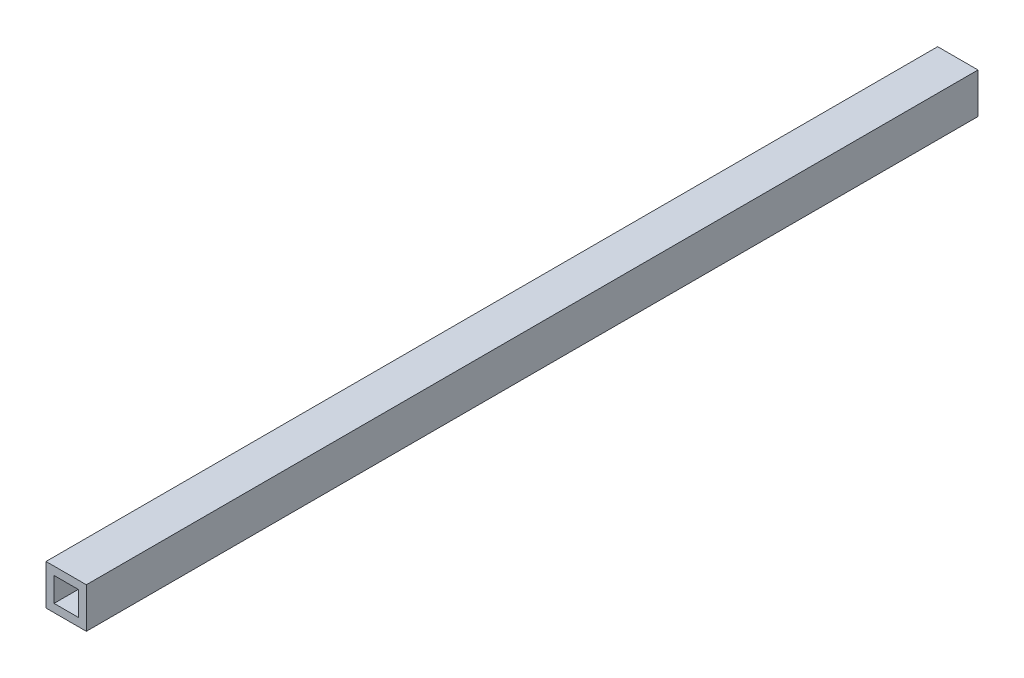
from build123d import *

# Parameters (mm, degrees)
SKETCH1_W           = 10
SKETCH1_H           = 10
SKETCH1_W_2         = 6
SKETCH1_H_2         = 6
BOSS_EXTRUDE1_DEPTH = 221


with BuildPart() as part:
    # Sketch1 → Boss-Extrude1 (new body)
    with BuildSketch(Plane.XY):
        Rectangle(SKETCH1_W, SKETCH1_H)
        Rectangle(SKETCH1_W_2, SKETCH1_H_2, mode=Mode.SUBTRACT)
    extrude(amount=BOSS_EXTRUDE1_DEPTH)


solid = part.part
